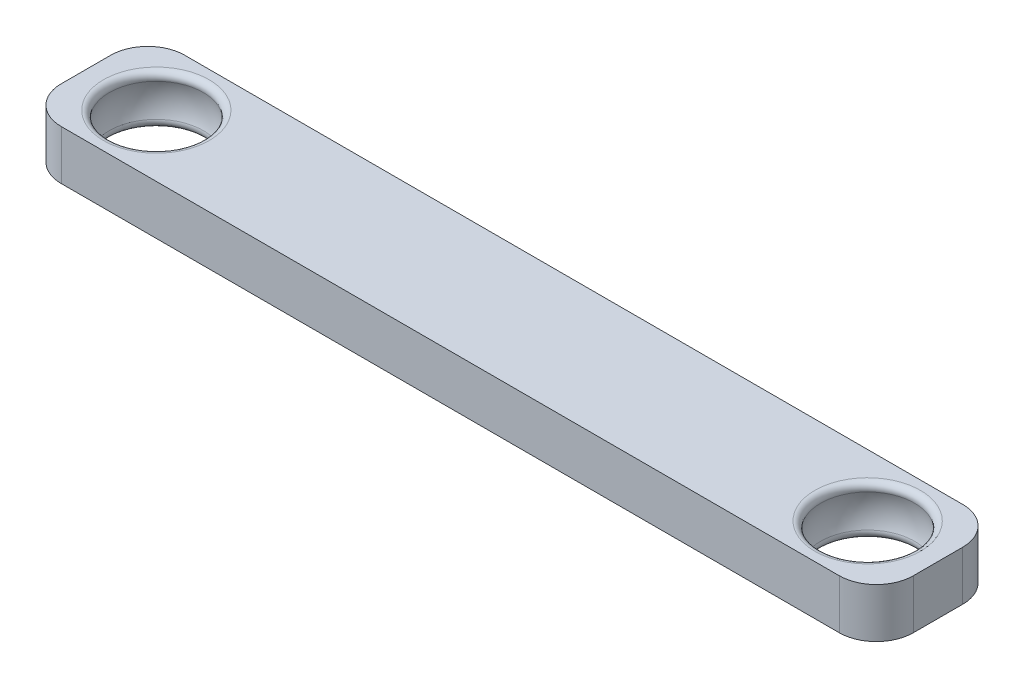
from build123d import *

# Parameters (mm, degrees)
SKETCH1_W           = 69
SKETCH1_H           = 10
BOSS_EXTRUDE1_DEPTH = 4
FILLET1_R           = 3
FILLET2_R           = 0.5


with BuildPart() as part:
    # Sketch1 → Boss-Extrude1 (new body)
    with BuildSketch(Plane(origin=(0, 0, 0), x_dir=(1, 0, 0), z_dir=(0, 1, 0))):
        Rectangle(SKETCH1_W, SKETCH1_H)
    extrude(amount=BOSS_EXTRUDE1_DEPTH)

    # Sketch2 → Cut-Revolve2 (revolve, cut)
    with BuildSketch(Plane.XY):
        with BuildLine():
            Line((-28.8, 4), (-28.8, 0))
            Line((-28.8, 0), (-32.3, 0))
            ThreePointArc((-32.3, 0), (-32.831128874, 2), (-32.3, 4))
            Line((-32.3, 4), (-28.8, 4))
        make_face()
    cut_revolve2 = revolve(axis=Axis((-28.8, 4, 0), (0, -1, 0)), mode=Mode.SUBTRACT)

    # Fillet1
    fillet1_edges = [part.edges().sort_by_distance(p)[0] for p in [
        (34.5, 2, 5),
        (-34.5, 2, 5),
        (-34.5, 2, -5),
        (34.5, 2, -5),
    ]]
    fillet(fillet1_edges, radius=FILLET1_R)

    # Mirror1: Cut-Revolve2 across plane
    add(cut_revolve2.mirror(Plane(origin=(0, 0, 0), x_dir=(0, 0, 1), z_dir=(1, 0, 0))), mode=Mode.SUBTRACT)

    # Fillet2
    fillet2_edges = [part.edges().sort_by_distance(p)[0] for p in [
        (-25.3, 4, 0),
        (-25.3, 0, 0),
        (25.3, 4, 0),
        (25.3, 0, 0),
    ]]
    fillet(fillet2_edges, radius=FILLET2_R)


solid = part.part
